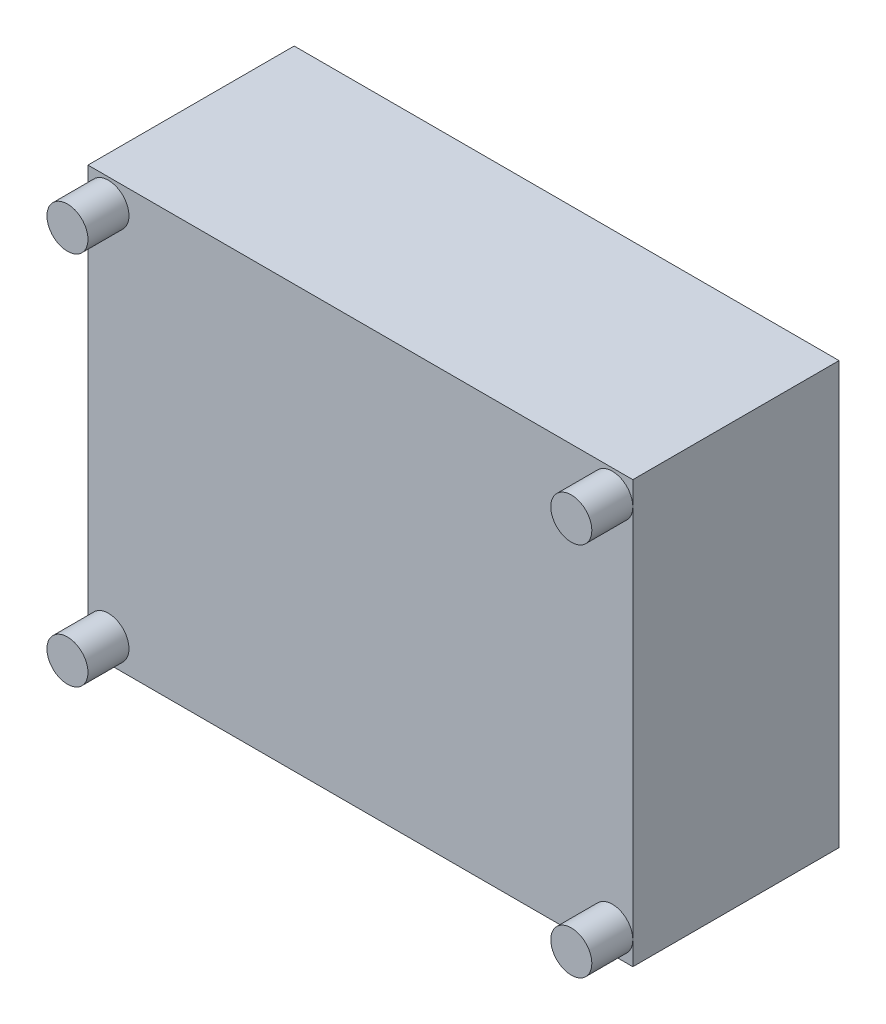
from build123d import *

# Parameters (mm, degrees)
ESQUISSE1_W             = 93
ESQUISSE1_H             = 72
BOSS_EXTRU_1_DEPTH      = 35.2
ESQUISSE2_R             = 1.75
ENL_V_MAT_EXTRU_1_DEPTH = 123.768236934
ESQUISSE3_R             = 3.5
BOSS_EXTRU_2_DEPTH      = 7


with BuildPart() as part:
    # Esquisse1 → Boss.-Extru.1 (new body)
    with BuildSketch(Plane.XY):
        with Locations((46.5, -36)):
            Rectangle(ESQUISSE1_W, ESQUISSE1_H)
    extrude(amount=BOSS_EXTRU_1_DEPTH)

    # Esquisse2 → Enlèv. mat.-Extru.1 (cut, through all)
    with BuildSketch(Plane(origin=(0, 0, 0), x_dir=(-1, 0, 0), z_dir=(0, 0, -1))):
        with Locations((-89.5, -4)):
            Circle(ESQUISSE2_R)
        with Locations((-3.5, -4)):
            Circle(ESQUISSE2_R)
        with Locations((-89.5, -68)):
            Circle(ESQUISSE2_R)
        with Locations((-3.5, -68)):
            Circle(ESQUISSE2_R)
    extrude(amount=-ENL_V_MAT_EXTRU_1_DEPTH, mode=Mode.SUBTRACT)

    # Esquisse3 → Boss.-Extru.2 (add)
    with BuildSketch(Plane.XY.offset(35.2)):
        with Locations((89.5, -68)):
            Circle(ESQUISSE3_R)
        with Locations(Location((3.5, -68, 0), (0, 0, 180))):
            Circle(ESQUISSE3_R)
        with Locations((89.5, -4)):
            Circle(ESQUISSE3_R)
        with Locations(Location((3.5, -4, 0), (0, 0, 180))):
            Circle(ESQUISSE3_R)
    extrude(amount=BOSS_EXTRU_2_DEPTH)


solid = part.part
